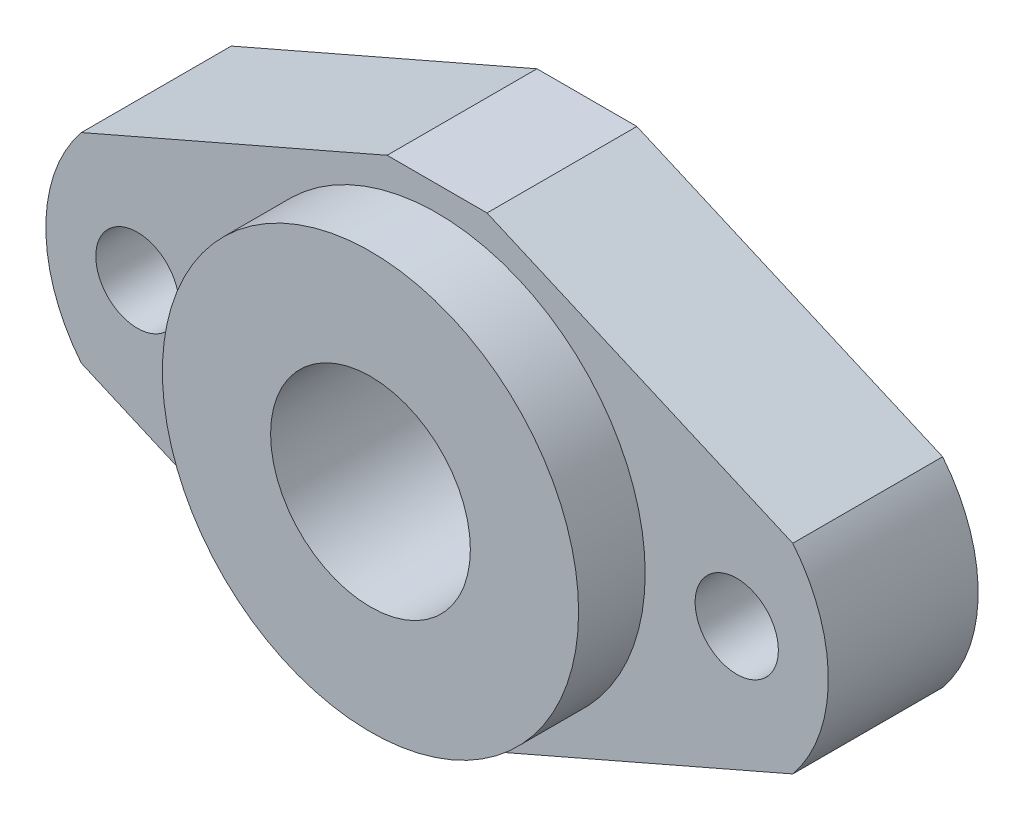
from build123d import *

# Parameters (mm, degrees)
SKETCH1_R           = 2.5
SKETCH1_R_2         = 6
BOSS_EXTRUDE1_DEPTH = 9
SKETCH2_R           = 12.5
SKETCH2_R_2         = 6
BOSS_EXTRUDE2_DEPTH = 4


with BuildPart() as part:
    # Sketch1 → Boss-Extrude1 (new body)
    with BuildSketch(Plane.XY):
        with BuildLine():
            Line((21.365459931, -6), (3, -14))
            Line((3, -14), (-3, -14))
            Line((-3, -14), (-21.365459931, -6))
            ThreePointArc((-21.365459931, -6), (-23.5, 0), (-21.365459931, 6))
            Line((-21.365459931, 6), (-3, 14))
            Line((-3, 14), (3, 14))
            Line((3, 14), (21.365459931, 6))
            ThreePointArc((21.365459931, 6), (23.5, 0), (21.365459931, -6))
        make_face()
        with Locations((-18, 0)):
            Circle(SKETCH1_R, mode=Mode.SUBTRACT)
        with Locations((18, 0)):
            Circle(SKETCH1_R, mode=Mode.SUBTRACT)
        Circle(SKETCH1_R_2, mode=Mode.SUBTRACT)
    extrude(amount=BOSS_EXTRUDE1_DEPTH)

    # Sketch2 → Boss-Extrude2 (add)
    with BuildSketch(Plane.XY.offset(9)):
        Circle(SKETCH2_R)
        Circle(SKETCH2_R_2, mode=Mode.SUBTRACT)
    extrude(amount=BOSS_EXTRUDE2_DEPTH)


solid = part.part
